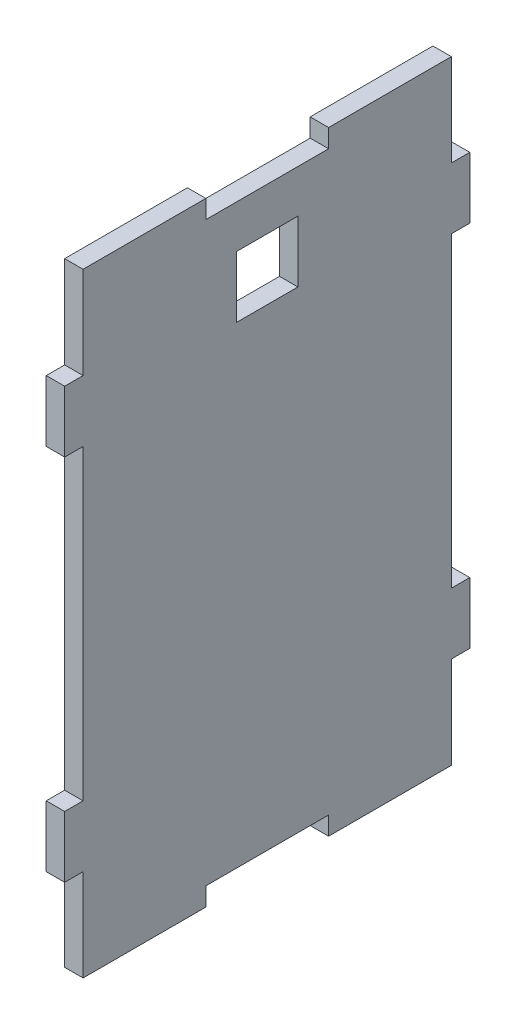
from build123d import *

# Parameters (mm, degrees)
SKETCH1_W           = 60
SKETCH1_H           = 100
BOSS_EXTRUDE1_DEPTH = 3
SKETCH2_W           = 3
SKETCH2_H           = 10
BOSS_EXTRUDE2_DEPTH = 3
SKETCH3_W           = 20
SKETCH3_H           = 3
CUT_EXTRUDE1_DEPTH  = 3
SKETCH4_W           = 10
SKETCH4_H           = 10
CUT_EXTRUDE2_DEPTH  = 3


with BuildPart() as part:
    # Sketch1 → Boss-Extrude1 (new body)
    with BuildSketch(Plane(origin=(0, 0, 0), x_dir=(0, 0, -1), z_dir=(1, 0, 0))):
        Rectangle(SKETCH1_W, SKETCH1_H)
    extrude(amount=BOSS_EXTRUDE1_DEPTH)

    # Sketch2 → Boss-Extrude2 (add)
    with BuildSketch(Plane(origin=(0, 0, 0), x_dir=(0, 0, -1), z_dir=(1, 0, 0))):
        with Locations((-31.5, -30)):
            Rectangle(SKETCH2_W, SKETCH2_H)
        with Locations((-31.5, 30)):
            Rectangle(SKETCH2_W, SKETCH2_H)
        with Locations((31.5, 30)):
            Rectangle(SKETCH2_W, SKETCH2_H)
        with Locations((31.5, -30)):
            Rectangle(SKETCH2_W, SKETCH2_H)
    extrude(amount=BOSS_EXTRUDE2_DEPTH)

    # Sketch3 → Cut-Extrude1 (cut)
    with BuildSketch(Plane(origin=(3, 0, 0), x_dir=(0, 0, -1), z_dir=(1, 0, 0))):
        with Locations((0, 48.5)):
            Rectangle(SKETCH3_W, SKETCH3_H)
        with Locations((0, -48.5)):
            Rectangle(SKETCH3_W, SKETCH3_H)
    extrude(amount=-CUT_EXTRUDE1_DEPTH, mode=Mode.SUBTRACT)

    # Sketch4 → Cut-Extrude2 (cut)
    with BuildSketch(Plane(origin=(3, 0, 0), x_dir=(0, 0, -1), z_dir=(1, 0, 0))):
        with Locations((0, 35)):
            Rectangle(SKETCH4_W, SKETCH4_H)
    extrude(amount=-CUT_EXTRUDE2_DEPTH, mode=Mode.SUBTRACT)


solid = part.part
